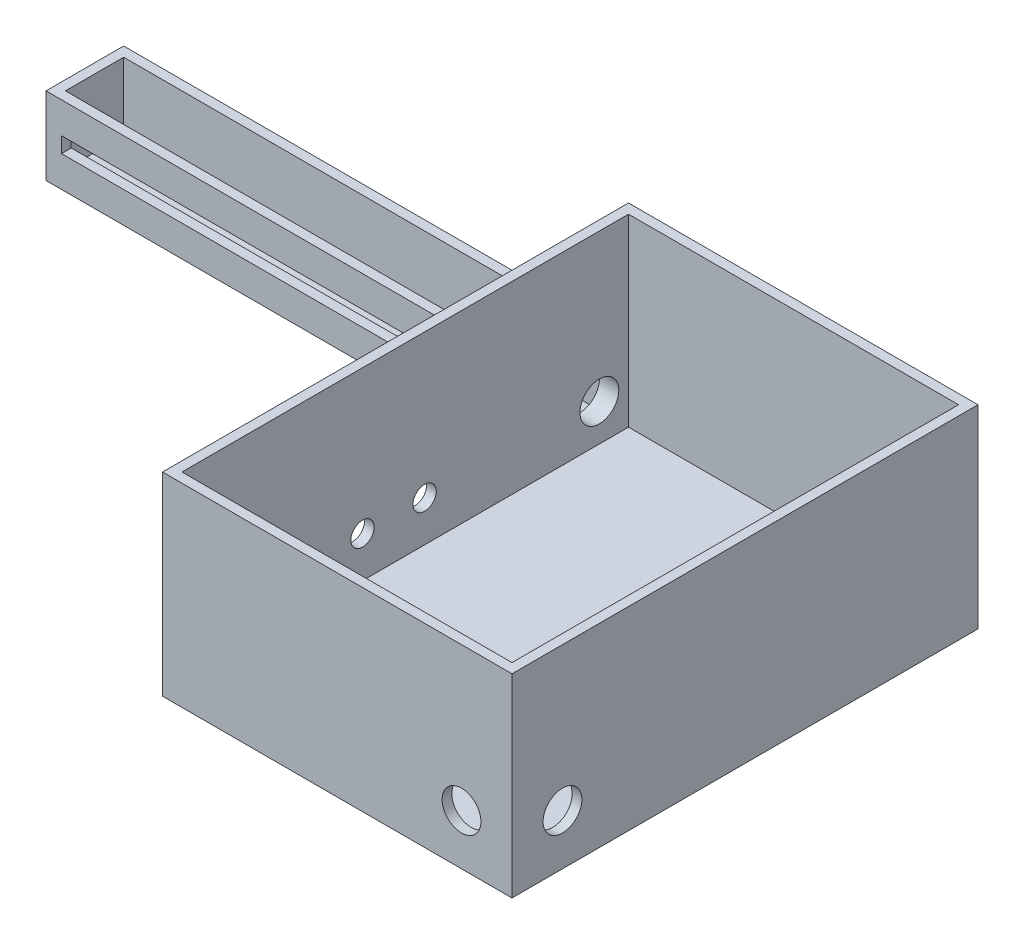
from build123d import *

# Parameters (mm, degrees)
BOSS_EXTRUDE1_DEPTH     = 63.5
SKETCH2_W               = 165.1
SKETCH2_H               = 25.4
CUT_EXTRUDE1_DEPTH      = 38.1
SKETCH3_W               = 107.95
SKETCH3_H               = 146.05
CUT_EXTRUDE2_DEPTH      = 60.325
SKETCH4_W               = 158.75
SKETCH4_H               = 19.05
CUT_EXTRUDE3_DEPTH      = 22.225
CUT_EXTRUDE5_DEPTH      = 20.32
CUT_EXTRUDE5_DEPTH_BACK = 20.32
SKETCH5_R               = 6.35
SKETCH6_W               = 154.94
SKETCH6_H               = 5.08
CUT_EXTRUDE6_DEPTH      = 10.16
SKETCH8_R               = 3.81
CUT_EXTRUDE8_DEPTH      = 12.7
SKETCH9_R               = 6.35
CUT_EXTRUDE9_DEPTH      = 12.7
SKETCH10_R              = 6.35
CUT_EXTRUDE10_DEPTH     = 12.7


with BuildPart() as part:
    # Sketch1 → Boss-Extrude1 (new body)
    with BuildSketch(Plane(origin=(0, 0, 0), x_dir=(1, 0, 0), z_dir=(0, 1, 0))):
        Polygon((-82.55, 12.7), (82.55, 12.7), (196.85, 12.7), (196.85, -139.7), (82.55, -139.7), (82.55, -12.7), (-82.55, -12.7), align=None)
    extrude(amount=BOSS_EXTRUDE1_DEPTH)

    # Sketch2 → Cut-Extrude1 (cut)
    with BuildSketch(Plane(origin=(0, 63.5, 0), x_dir=(1, 0, 0), z_dir=(0, 1, 0))):
        Rectangle(SKETCH2_W, SKETCH2_H)
    extrude(amount=-CUT_EXTRUDE1_DEPTH, mode=Mode.SUBTRACT)

    # Sketch3 → Cut-Extrude2 (cut)
    with BuildSketch(Plane(origin=(0, 63.5, 0), x_dir=(1, 0, 0), z_dir=(0, 1, 0))):
        with Locations((139.7, -63.5)):
            Rectangle(SKETCH3_W, SKETCH3_H)
    extrude(amount=-CUT_EXTRUDE2_DEPTH, mode=Mode.SUBTRACT)

    # Sketch4 → Cut-Extrude3 (cut)
    with BuildSketch(Plane(origin=(0, 25.4, 0), x_dir=(1, 0, 0), z_dir=(0, 1, 0))):
        Rectangle(SKETCH4_W, SKETCH4_H)
    extrude(amount=-CUT_EXTRUDE3_DEPTH, mode=Mode.SUBTRACT)

    # Sketch5 → Cut-Extrude5 (cut, two sides: drawn at the far end of the back side and taken through both)
    with BuildSketch(Plane.ZY.offset(-79.375).offset(-CUT_EXTRUDE5_DEPTH_BACK)):
        with Locations(Location((0, 15.24, 0), (0, 0, 180))):
            Circle(SKETCH5_R)
    extrude(amount=CUT_EXTRUDE5_DEPTH + CUT_EXTRUDE5_DEPTH_BACK, mode=Mode.SUBTRACT)

    # Sketch6 → Cut-Extrude6 (cut)
    with BuildSketch(Plane.XY.offset(12.7)):
        with Locations((0, 12.7)):
            Rectangle(SKETCH6_W, SKETCH6_H)
    extrude(amount=-CUT_EXTRUDE6_DEPTH, mode=Mode.SUBTRACT)

    # Sketch8 → Cut-Extrude8 (cut)
    with BuildSketch(Plane.ZY.offset(-82.55)):
        with Locations((57.15, 16.51)):
            Circle(SKETCH8_R)
        with Locations((77.47, 16.51)):
            Circle(SKETCH8_R)
        with Locations((97.79, 16.51)):
            Circle(SKETCH8_R)
    extrude(amount=-CUT_EXTRUDE8_DEPTH, mode=Mode.SUBTRACT)

    # Sketch9 → Cut-Extrude9 (cut)
    with BuildSketch(Plane.XY.offset(139.7)):
        with Locations((180.34, 16.51)):
            Circle(SKETCH9_R)
    extrude(amount=-CUT_EXTRUDE9_DEPTH, mode=Mode.SUBTRACT)

    # Sketch10 → Cut-Extrude10 (cut)
    with BuildSketch(Plane(origin=(196.85, 0, 0), x_dir=(0, 0, -1), z_dir=(1, 0, 0))):
        with Locations((-123.19, 16.51)):
            Circle(SKETCH10_R)
    extrude(amount=-CUT_EXTRUDE10_DEPTH, mode=Mode.SUBTRACT)


solid = part.part
